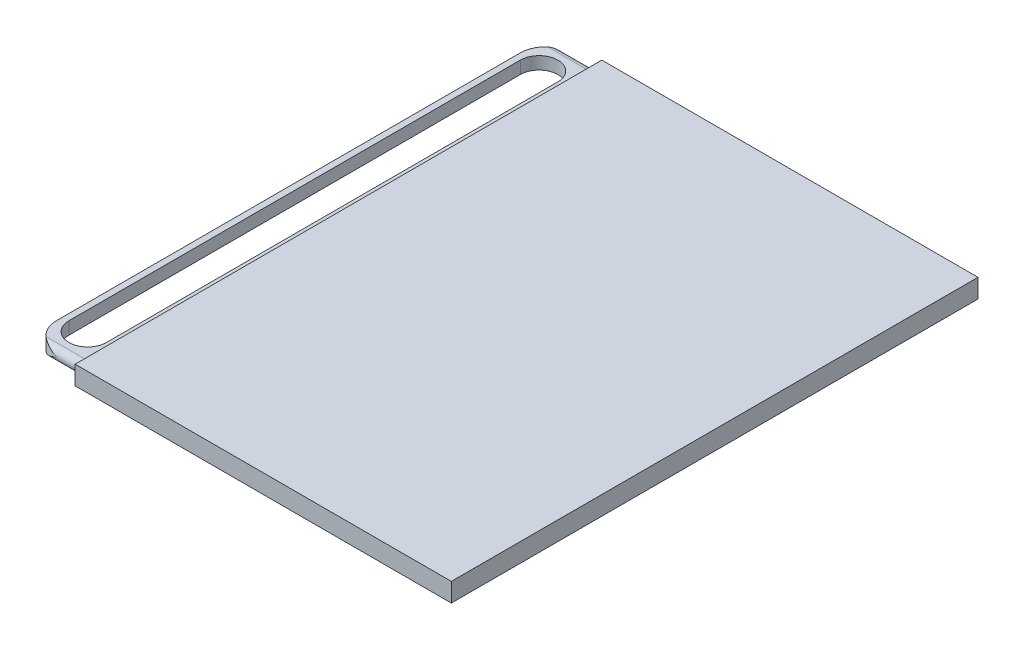
from build123d import *

# Parameters (mm, degrees)
BOSS_EXTRUDE1_DEPTH = 7.5
SKETCH2_R           = 2.5
BOSS_EXTRUDE2_DEPTH = 20
SKETCH3_R           = 7.5
CUT_EXTRUDE1_DEPTH  = 271.257400454
CUT_EXTRUDE2_DEPTH  = 20


with BuildPart() as part:
    # Sketch1 → Boss-Extrude1 (new body)
    with BuildSketch(Plane(origin=(0, 0, 0), x_dir=(1, 0, 0), z_dir=(0, 1, 0))):
        Polygon((0, 0), (-150, 0), (-150, -55), (-150, -155), (-150, -210), (0, -210), align=None)
    extrude(amount=BOSS_EXTRUDE1_DEPTH)

    # Sketch2 → Boss-Extrude2 (add)
    with BuildSketch(Plane.ZY.offset(150)):
        with BuildLine():
            Line((205, 6.25), (5, 6.25))
            ThreePointArc((5, 6.25), (6.767766953, 5.517766953), (7.5, 3.75))
            ThreePointArc((7.5, 3.75), (6.767766953, 1.982233047), (5, 1.25))
            Line((5, 1.25), (205, 1.25))
            ThreePointArc((205, 1.25), (202.5, 3.75), (205, 6.25))
        make_face()
        with Locations((205, 3.75)):
            Circle(SKETCH2_R)
        with Locations((5, 3.75)):
            Circle(SKETCH2_R)
    extrude(amount=BOSS_EXTRUDE2_DEPTH)

    # Sketch3 → Cut-Extrude1 (cut, through all)
    with BuildSketch(Plane(origin=(0, 6.25, 0), x_dir=(1, 0, 0), z_dir=(0, 1, 0))):
        with BuildLine():
            ThreePointArc((-152.5, -15), (-160, -22.5), (-167.5, -15))
            Line((-167.5, -15), (-167.5, -195))
            ThreePointArc((-167.5, -195), (-160, -187.5), (-152.5, -195))
            Line((-152.5, -195), (-152.5, -15))
        make_face()
        with Locations((-160, -15)):
            Circle(SKETCH3_R)
        with Locations((-160, -195)):
            Circle(SKETCH3_R)
    extrude(amount=-CUT_EXTRUDE1_DEPTH, mode=Mode.SUBTRACT)

    # Sketch4 → Cut-Extrude2 (cut)
    with BuildSketch(Plane(origin=(0, 6.25, 0), x_dir=(1, 0, 0), z_dir=(0, 1, 0))):
        with BuildLine():
            ThreePointArc((-166.614378278, -5), (-163.535533906, -3.145856533), (-160, -2.5))
            Line((-160, -2.5), (-170, -2.5))
            Line((-170, -2.5), (-170, -5))
            Line((-170, -5), (-166.614378278, -5))
        make_face()
        with BuildLine():
            ThreePointArc((-170, -12.5), (-169.114378278, -8.385621722), (-166.614378278, -5))
            Line((-166.614378278, -5), (-170, -5))
            Line((-170, -5), (-170, -12.5))
        make_face()
        with BuildLine():
            ThreePointArc((-160, -207.5), (-163.535533906, -206.854143467), (-166.614378278, -205))
            Line((-166.614378278, -205), (-170, -205))
            Line((-170, -205), (-170, -207.5))
            Line((-170, -207.5), (-160, -207.5))
        make_face()
        with BuildLine():
            Line((-170, -205), (-166.614378278, -205))
            ThreePointArc((-166.614378278, -205), (-169.114378278, -201.614378278), (-170, -197.5))
            Line((-170, -197.5), (-170, -205))
        make_face()
    extrude(amount=-CUT_EXTRUDE2_DEPTH, mode=Mode.SUBTRACT)


solid = part.part
